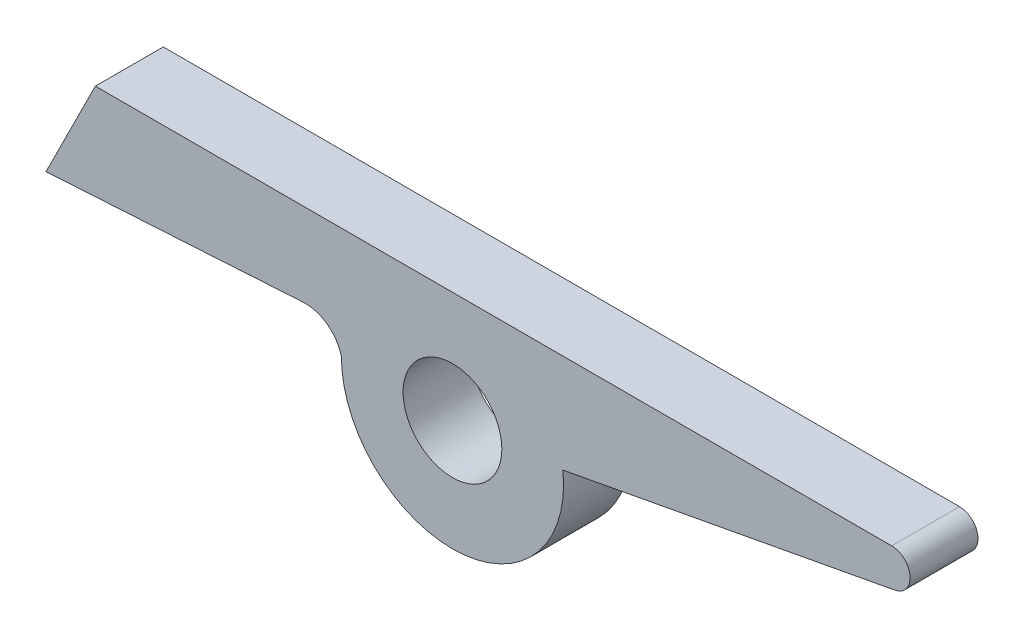
from build123d import *

# Parameters (mm, degrees)
SKETCH3_R           = 4
BOSS_EXTRUDE1_DEPTH = 5.5


with BuildPart() as part:
    # Sketch3 → Boss-Extrude1 (new body)
    with BuildSketch(Plane.XY):
        with BuildLine():
            Line((35.572698846, 9), (-28.927301154, 9))
            Line((-28.927301154, 9), (-32.927301154, 1))
            Line((-32.927301154, 1), (-12.087578676, 2.254578437))
            ThreePointArc((-12.087578676, 2.254578437), (-10.138135968, 1.682819545), (-9, 0))
            ThreePointArc((-9, 0), (0.50116839, -8.986035291), (8.944184499, 1.000781519))
            Line((8.944184499, 1.000781519), (35.848085015, 6.02549586))
            ThreePointArc((35.848085015, 6.02549586), (37.066311281, 7.638281941), (35.572698846, 9))
        make_face()
        Circle(SKETCH3_R, mode=Mode.SUBTRACT)
    extrude(amount=BOSS_EXTRUDE1_DEPTH)


solid = part.part
